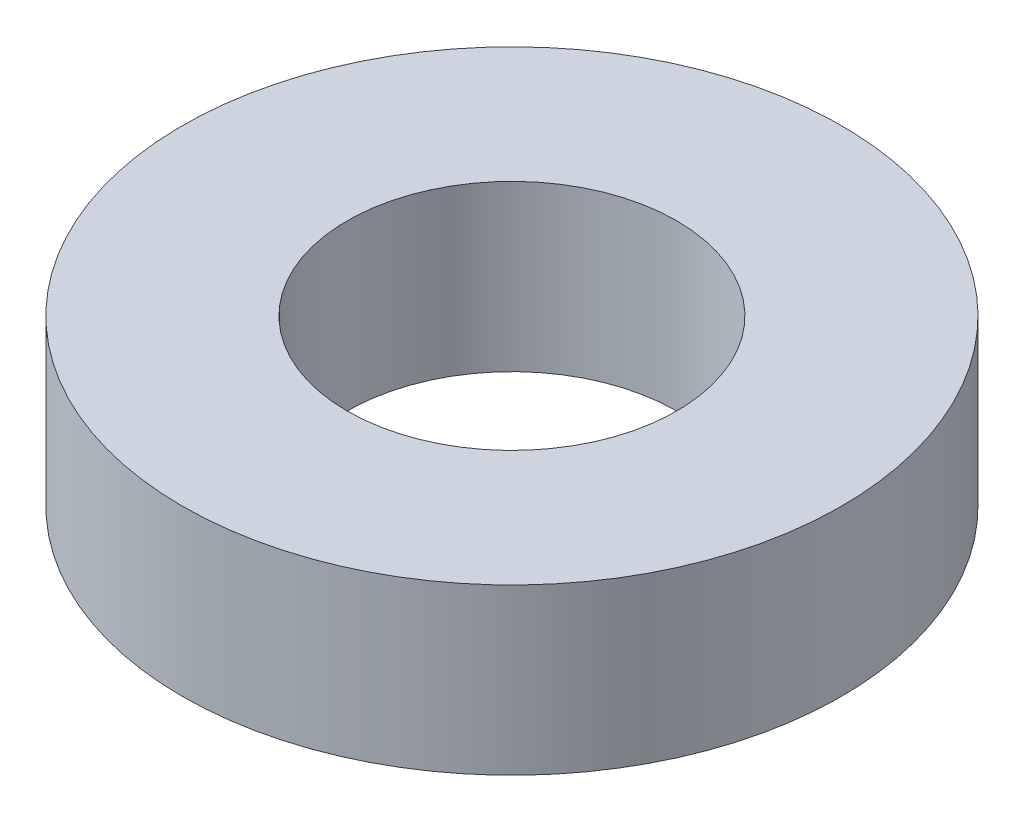
from build123d import *

# Parameters (mm, degrees)
SKETCH1_R           = 25.4
SKETCH1_R_2         = 12.7
BOSS_EXTRUDE1_DEPTH = 12.7


with BuildPart() as part:
    # Sketch1 → Boss-Extrude1 (new body)
    with BuildSketch(Plane(origin=(0, 0, 0), x_dir=(1, 0, 0), z_dir=(0, 1, 0))):
        with Locations(Location((0, 0, 0), (0, 0, 270))):
            Circle(SKETCH1_R)
        with Locations(Location((0, 0, 0), (0, 0, 270))):
            Circle(SKETCH1_R_2, mode=Mode.SUBTRACT)
    extrude(amount=BOSS_EXTRUDE1_DEPTH)


solid = part.part
